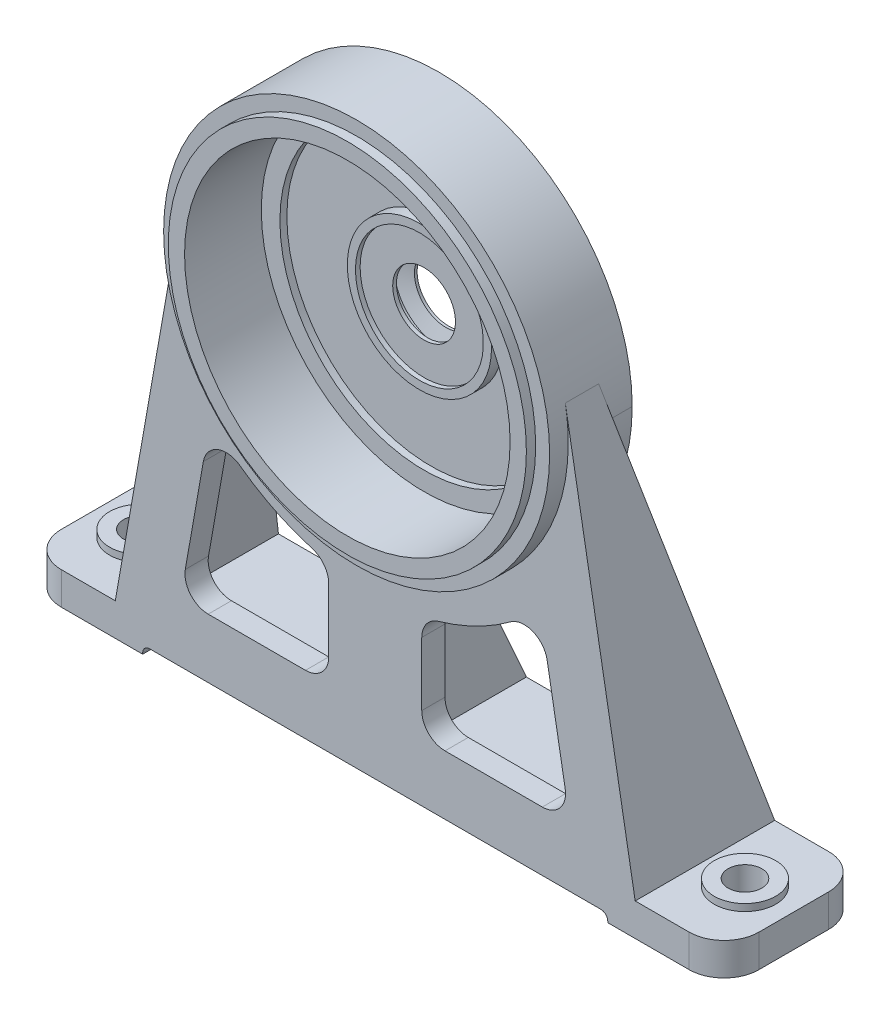
from build123d import *

# Parameters (mm, degrees)
SKETCH_1_R                 = 83
EXTRUDE_1_DEPTH            = 39.5
SKETCH_3_R                 = 34.5
EXTRUDE_2_DEPTH            = 43.5
SKETCH_4_OUTSIDE_W         = 215.752
SKETCH_4_OUTSIDE_H         = 215.752
SKETCH_4_OUTSIDE_R         = 77
CUT_EXTRUDE_1_DEPTH        = 4
EXTRUDE_START              = -170
SKETCH_5_W                 = 300
SKETCH_5_H                 = 60
EXTRUDE_3_DEPTH            = 14
FILLET_1_R                 = 15
CUT_EXTRUDE_1_2_DEPTH      = 238.873916183
CUT_EXTRUDE_1_2_DEPTH_BACK = 238.873916183
SKETCH_6_W                 = 200
SKETCH_6_H                 = 3.5
FILLET_2_R                 = 3
EXTRUDE_4_REACH            = 236.521
CUT_EXTRUDE_START          = -50
CUT_EXTRUDE_2_DEPTH        = 50
RIB_1_REACH                = 239.874
SKETCH_11_WALL_W           = 557.655591688
SKETCH_11_WALL_H           = 10
CUT_EXTRUDE_3_DEPTH        = 233.163735325
SKETCH_13_R                = 13.25
EXTRUDE_5_DEPTH            = 3
SKETCH_14_R                = 7.25
CUT_EXTRUDE_4_DEPTH        = 289.75595232
CUT_EXTRUDE_5_DEPTH        = 238.873916183
CUT_EXTRUDE_5_DEPTH_BACK   = 33
SKETCH_15_R                = 70
SKETCH_16_R                = 62
CUT_EXTRUDE_6_DEPTH        = 3
SKETCH_17_R                = 31
EXTRUDE_6_DEPTH            = 5


with BuildPart() as part:
    # 草图1 → 凸台-拉伸1 (new body)
    with BuildSketch(Plane.XY):
        Circle(SKETCH_1_R)
    extrude(amount=-EXTRUDE_1_DEPTH)

    # 草图3 → 凸台-拉伸2 (add)
    with BuildSketch(Plane.XY):
        Circle(SKETCH_3_R)
    extrude(amount=-EXTRUDE_2_DEPTH)

    # 草图4 outside → Cut-Extrude 1 (cut)
    with BuildSketch(Plane.XY):
        Rectangle(SKETCH_4_OUTSIDE_W, SKETCH_4_OUTSIDE_H)
        Circle(SKETCH_4_OUTSIDE_R, mode=Mode.SUBTRACT)
    extrude(amount=-CUT_EXTRUDE_1_DEPTH, mode=Mode.SUBTRACT)



with BuildPart() as body_2:
    # 草图5 → 凸台-拉伸3 (new body)
    with BuildSketch(Plane(origin=(0, 0, 0), x_dir=(1, 0, 0), z_dir=(0, 1, 0)).offset(EXTRUDE_START)):
        with Locations((0, 42)):
            Rectangle(SKETCH_5_W, SKETCH_5_H)
    extrude(amount=EXTRUDE_3_DEPTH)

    # 圆角1
    fillet_1_edges = [body_2.edges().sort_by_distance(p)[0] for p in [
        (-150, -163, -72),
        (150, -163, -72),
        (150, -163, -12),
        (-150, -163, -12),
    ]]
    fillet(fillet_1_edges, radius=FILLET_1_R)

    # 草图6 → Cut-Extrude 1 2 (cut, two sides: drawn at the far end of the back side and taken through both)
    with BuildSketch(Plane(origin=(0, 0, -72), x_dir=(-1, 0, 0), z_dir=(0, 0, -1)).offset(-CUT_EXTRUDE_1_2_DEPTH_BACK)):
        with Locations((0, -168.25)):
            Rectangle(SKETCH_6_W, SKETCH_6_H)
    extrude(amount=CUT_EXTRUDE_1_2_DEPTH + CUT_EXTRUDE_1_2_DEPTH_BACK, mode=Mode.SUBTRACT)

    # 圆角2
    fillet_2_edges = [body_2.edges().sort_by_distance(p)[0] for p in [
        (100, -166.5, -42),
        (-100, -166.5, -42),
    ]]
    fillet(fillet_2_edges, radius=FILLET_2_R)


with BuildPart() as part_1:
    add(part.part)

    add(body_2.part)  # 凸台-拉伸4 merges body 2
    # 凸台-拉伸4: up to this plane
    extrude_4_end = Plane(origin=(0, -156, -72), z_dir=(0, 0.2588190451025216, -0.9659258262890681))
    # 草图8 → 凸台-拉伸4 (add, up to the surface)
    with BuildSketch(Plane.XY.offset(-12), mode=Mode.PRIVATE) as extrude_4_sk1:
        with BuildLine():
            Line((-81.7390435, 14.412798746), (-111.787417777, -156))
            Line((-111.787417777, -156), (111.787417777, -156))
            Line((111.787417777, -156), (81.7390435, 14.412798746))
            ThreePointArc((81.7390435, 14.412798746), (0, -83), (-81.7390435, 14.412798746))
        make_face()
    extrude_4_tool1 = split(extrude(extrude_4_sk1.sketch, amount=-EXTRUDE_4_REACH, mode=Mode.PRIVATE), bisect_by=extrude_4_end, keep=Keep.BOTH, mode=Mode.PRIVATE)
    add(extrude_4_tool1.solids().sort_by_distance((0, -106.993389, -12))[0])

    # 草图9 → 切除-拉伸2 (cut)
    with BuildSketch(Plane(origin=(0, 0, -72), x_dir=(-1, 0, 0), z_dir=(0, 0, -1)).offset(CUT_EXTRUDE_START)):
        with BuildLine():
            Line((101.633151658, -156), (-101.633151658, -156))
            Line((-101.633151658, -156), (-78.749519446, -26.220472669))
            ThreePointArc((-78.749519446, -26.220472669), (-77.188766281, -30.510561451), (-75.394499314, -34.708348754))
            ThreePointArc((-75.394499314, -34.708348754), (0, -83), (75.394499314, -34.708348754))
            ThreePointArc((75.394499314, -34.708348754), (77.188766281, -30.510561451), (78.749519446, -26.220472669))
            Line((78.749519446, -26.220472669), (101.633151658, -156))
        make_face()
    extrude(amount=CUT_EXTRUDE_2_DEPTH, mode=Mode.SUBTRACT)

    # 草图11 wall → 筋1 (add, up to next)
    with BuildSketch(Plane(origin=(0, -119.5, -55.75), x_dir=(0, -0.913553334727, -0.406718950392), z_dir=(0, 0.406718950392, -0.913553334727)), mode=Mode.PRIVATE) as rib_1_sk1:
        Rectangle(SKETCH_11_WALL_W, SKETCH_11_WALL_H)
    rib_1_tool1 = extrude(rib_1_sk1.sketch, amount=-RIB_1_REACH, mode=Mode.PRIVATE) - part_1.part
    add(rib_1_tool1.solids().sort_by_distance((0, -119.5, -55.75))[0])

    # 草图12 → 切除-拉伸3 (cut, symmetric)
    with BuildSketch(Plane(origin=(0, 0, -22), x_dir=(-1, 0, 0), z_dir=(0, 0, -1))):
        with BuildLine():
            Line((20, -103.749698795), (20, -131))
            ThreePointArc((20, -131), (22.928932188, -138.071067812), (30, -141))
            Line((30, -141), (71.839311843, -141))
            ThreePointArc((71.839311843, -141), (79.499756275, -137.427876097), (81.687389373, -129.263518223))
            Line((81.687389373, -129.263518223), (73.918806065, -85.205692943))
            ThreePointArc((73.918806065, -85.205692943), (67.785395386, -77.657711882), (58.138253671, -78.891973357))
            ThreePointArc((58.138253671, -78.891973357), (43.356118765, -87.887695189), (27.222222222, -94.143245203))
            ThreePointArc((27.222222222, -94.143245203), (22.006947461, -97.740446669), (20, -103.749698795))
        make_face()
    cut_extrude_3 = extrude(amount=CUT_EXTRUDE_3_DEPTH, both=True, mode=Mode.SUBTRACT)

    # 镜向1: 切除-拉伸3 across plane
    add(cut_extrude_3.mirror(Plane(origin=(0, 0, 0), x_dir=(0, 0, 1), z_dir=(1, 0, 0))), mode=Mode.SUBTRACT)

    # 草图13 → 凸台-拉伸5 (add)
    with BuildSketch(Plane(origin=(0, -156, 0), x_dir=(1, 0, 0), z_dir=(0, 1, 0))):
        with Locations(Location((-130, 41, 0), (0, 0, 90))):
            Circle(SKETCH_13_R)
    extrude_5 = extrude(amount=EXTRUDE_5_DEPTH)

    # 草图14 → 切除-拉伸4 (cut, symmetric)
    with BuildSketch(Plane(origin=(0, -153, 0), x_dir=(1, 0, 0), z_dir=(0, 1, 0))):
        with Locations(Location((-130, 41, 0), (0, 0, 270))):
            Circle(SKETCH_14_R)
    cut_extrude_4 = extrude(amount=CUT_EXTRUDE_4_DEPTH, both=True, mode=Mode.SUBTRACT)

    # 镜向2: 凸台-拉伸5, 切除-拉伸4 across plane
    add(extrude_5.mirror(Plane(origin=(0, 0, 0), x_dir=(0, 0, 1), z_dir=(1, 0, 0))))
    add(cut_extrude_4.mirror(Plane(origin=(0, 0, 0), x_dir=(0, 0, 1), z_dir=(1, 0, 0))), mode=Mode.SUBTRACT)

    # 草图15 → 切除-拉伸5 (cut, two sides: drawn at the far end of the back side and taken through both)
    with BuildSketch(Plane.XY.offset(-CUT_EXTRUDE_5_DEPTH_BACK)):
        with Locations(Location((0, 0, 0), (0, 0, 180))):
            Circle(SKETCH_15_R)
    extrude(amount=CUT_EXTRUDE_5_DEPTH + CUT_EXTRUDE_5_DEPTH_BACK, mode=Mode.SUBTRACT)

    # 草图16 → 切除-拉伸6 (cut)
    with BuildSketch(Plane.XY.offset(-33)):
        Circle(SKETCH_16_R)
    extrude(amount=-CUT_EXTRUDE_6_DEPTH, mode=Mode.SUBTRACT)

    # 草图17 → 凸台-拉伸6 (add)
    with BuildSketch(Plane.XY.offset(-36)):
        Circle(SKETCH_17_R)
    extrude(amount=EXTRUDE_6_DEPTH)

    # 草图18 → 切除-旋转1 (revolve, cut)
    with BuildSketch(Plane(origin=(0, 0, 0), x_dir=(0, 0, -1), z_dir=(1, 0, 0)), mode=Mode.PRIVATE) as cut_revolve_1_sk:
        Polygon((31, 0), (31, 27.5), (33, 27.5), (33, 13.5), (34.624355653, 13.5), (36.5, 20.5), (40.5, 20.5), (42.375644347, 13.5), (43.5, 13.5), (43.5, 0), align=None)
    revolve(cut_revolve_1_sk.sketch.rotate(Axis((0, 0, -43.5), (0, 0, 1)), 90), axis=Axis((0, 0, -43.5), (0, 0, 1)), mode=Mode.SUBTRACT)


solid = part_1.part
